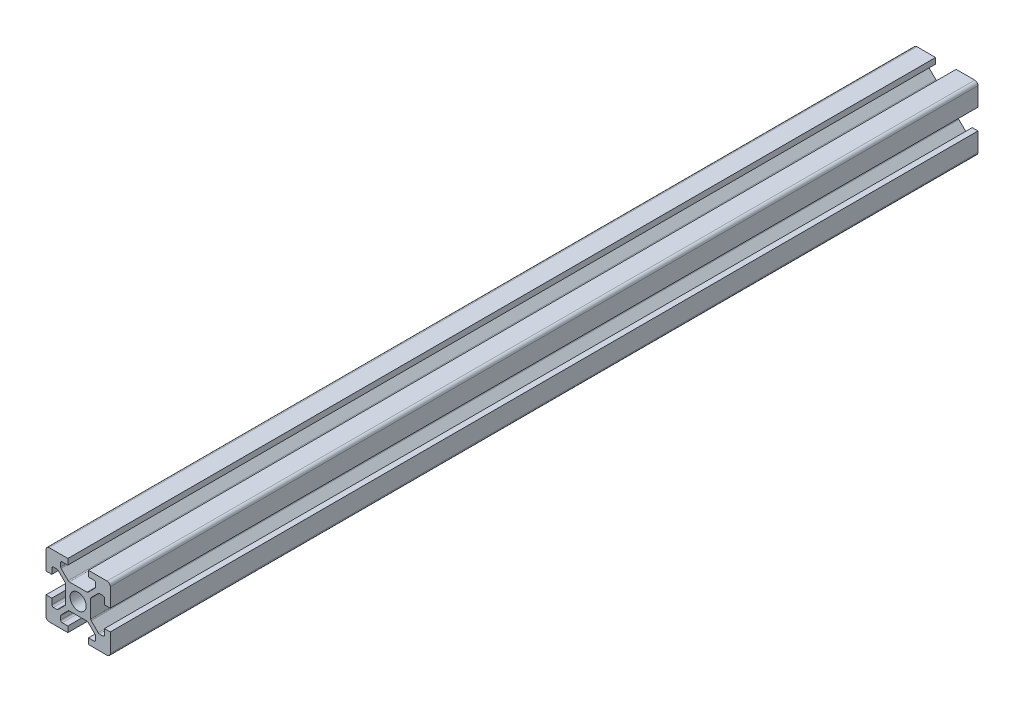
from build123d import *

# Parameters (mm, degrees)
SKETCH1_R           = 2.5
BOSS_EXTRUDE1_DEPTH = 270
FILLET1_R           = 1
FILLET2_R           = 0.5
FILLET3_R           = 0.5
FILLET4_R           = 0.5
FILLET5_R           = 0.5


with BuildPart() as part:
    # Sketch1 → Boss-Extrude1 (new body)
    with BuildSketch(Plane.XY):
        Polygon((13.2, 0), (13.2, 1.8), (15.45, 1.8), (15.45, 3.6), (12.95, 6.1), (7.05, 6.1), (4.55, 3.6), (4.55, 1.8), (6.8, 1.8), (6.8, 0), (0, 0), (0, 6.8), (1.8, 6.8), (1.8, 4.55), (3.6, 4.55), (6.1, 7.05), (6.1, 12.95), (3.6, 15.45), (1.8, 15.45), (1.8, 13.2), (0, 13.2), (0, 20), (6.8, 20), (6.8, 18.2), (4.55, 18.2), (4.55, 16.4), (7.05, 13.9), (12.95, 13.9), (15.45, 16.4), (15.45, 18.2), (13.2, 18.2), (13.2, 20), (20, 20), (20, 13.2), (18.2, 13.2), (18.2, 15.45), (16.4, 15.45), (13.9, 12.95), (13.9, 7.05), (16.4, 4.55), (18.2, 4.55), (18.2, 6.8), (20, 6.8), (20, 0), align=None)
        with Locations((10, 10)):
            Circle(SKETCH1_R, mode=Mode.SUBTRACT)
    extrude(amount=BOSS_EXTRUDE1_DEPTH)

    # Fillet1
    fillet1_edges = [part.edges().sort_by_distance(p)[0] for p in [
        (0, 0, 135),
        (0, 20, 135),
        (20, 20, 135),
        (20, 0, 135),
    ]]
    fillet(fillet1_edges, radius=FILLET1_R)

    # Fillet2
    fillet2_edges = [part.edges().sort_by_distance(p)[0] for p in [
        (4.55, 18.2, 135),
        (4.55, 16.4, 135),
        (7.05, 13.9, 135),
        (12.95, 13.9, 135),
        (15.45, 16.4, 135),
        (15.45, 18.2, 135),
    ]]
    fillet(fillet2_edges, radius=FILLET2_R)

    # Fillet3
    fillet3_edges = [part.edges().sort_by_distance(p)[0] for p in [
        (18.2, 15.45, 135),
        (16.4, 15.45, 135),
        (13.9, 12.95, 135),
        (13.9, 7.05, 135),
        (16.4, 4.55, 135),
        (18.2, 4.55, 135),
    ]]
    fillet(fillet3_edges, radius=FILLET3_R)

    # Fillet4
    fillet4_edges = [part.edges().sort_by_distance(p)[0] for p in [
        (1.8, 4.55, 135),
        (3.6, 4.55, 135),
        (6.1, 7.05, 135),
        (6.1, 12.95, 135),
        (3.6, 15.45, 135),
        (1.8, 15.45, 135),
    ]]
    fillet(fillet4_edges, radius=FILLET4_R)

    # Fillet5
    fillet5_edges = [part.edges().sort_by_distance(p)[0] for p in [
        (15.45, 1.8, 135),
        (15.45, 3.6, 135),
        (12.95, 6.1, 135),
        (7.05, 6.1, 135),
        (4.55, 3.6, 135),
        (4.55, 1.8, 135),
    ]]
    fillet(fillet5_edges, radius=FILLET5_R)


solid = part.part
